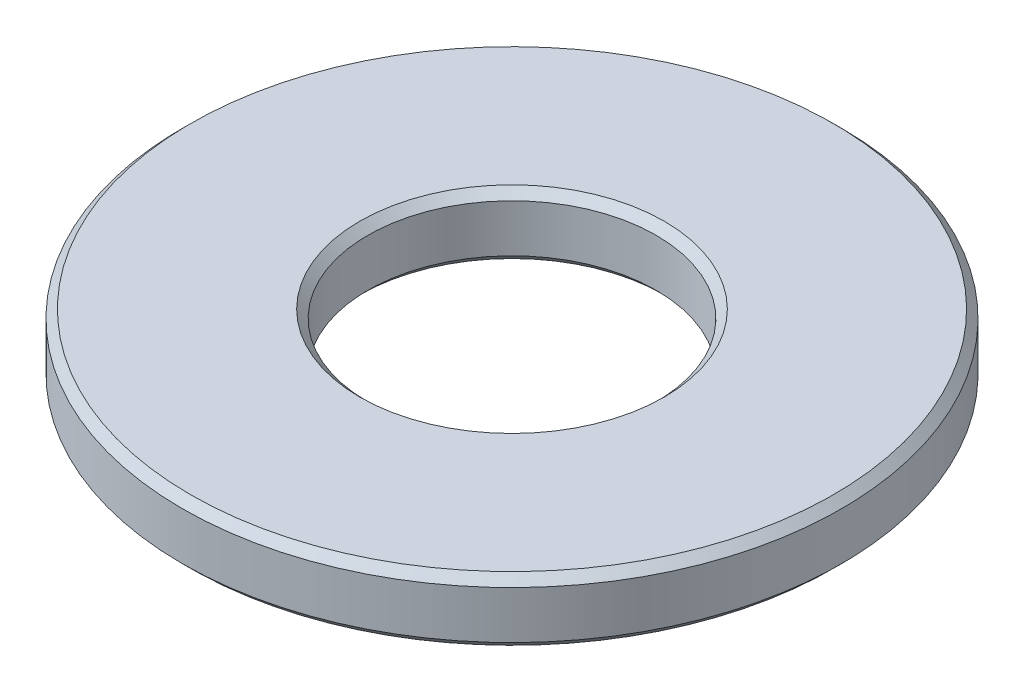
from build123d import *

# Parameters (mm, degrees)
SKETCH1_W     = 4.572
SKETCH1_H     = 1.5748
CHAMFER1_SIZE = 0.2


with BuildPart() as part:
    # Sketch1 → Revolve1 (revolve)
    with BuildSketch(Plane(origin=(0, 0, 0), x_dir=(-1, 0, 0), z_dir=(0, 0, -1)), mode=Mode.PRIVATE) as revolve1_sk:
        with Locations((-5.842, -0.7874)):
            Rectangle(SKETCH1_W, SKETCH1_H)
    revolve(revolve1_sk.sketch.rotate(Axis((0, -1.5748, 0), (0, 1, 0)), 270), axis=Axis((0, -1.5748, 0), (0, 1, 0)))

    # Chamfer1
    chamfer1_edges = [part.edges().sort_by_distance(p)[0] for p in [
        (0, 0, -3.556),
        (0, -1.5748, -3.556),
        (0, -1.5748, -8.128),
        (0, 0, -8.128),
    ]]
    chamfer(chamfer1_edges, length=CHAMFER1_SIZE)


solid = part.part
